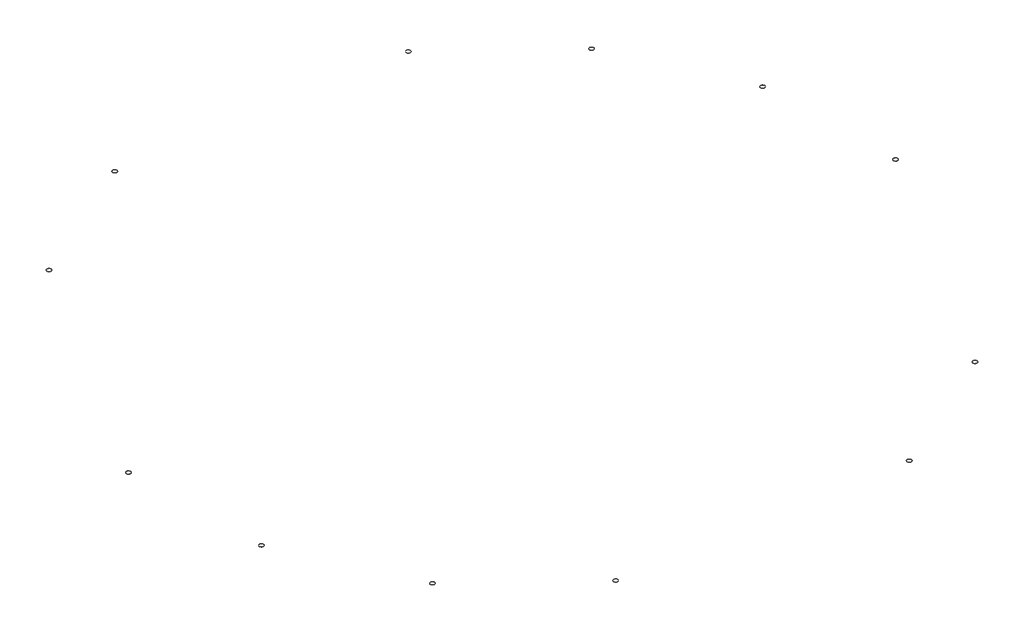
from build123d import *

# Parameters (mm, degrees)
SKETCH2_R              = 25.4
SKETCH2_R_2            = 22.225
BOSS_EXTRUDE1_DEPTH    = 3.175
BOSS_EXTRUDE1_2_DEPTH  = 3.175
BOSS_EXTRUDE1_3_DEPTH  = 3.175
BOSS_EXTRUDE1_4_DEPTH  = 3.175
BOSS_EXTRUDE1_5_DEPTH  = 3.175
BOSS_EXTRUDE1_6_DEPTH  = 3.175
BOSS_EXTRUDE1_7_DEPTH  = 3.175
BOSS_EXTRUDE1_8_DEPTH  = 3.175
BOSS_EXTRUDE1_9_DEPTH  = 3.175
BOSS_EXTRUDE1_10_DEPTH = 3.175
BOSS_EXTRUDE1_11_DEPTH = 3.175
BOSS_EXTRUDE1_12_DEPTH = 3.175


with BuildPart() as part:
    # Sketch2 → Boss-Extrude1 (new body)
    with BuildSketch(Plane(origin=(0, 0, 0), x_dir=(1, 0, 0), z_dir=(0, 1, 0))):
        with Locations(Location((-3790.37532596, -857.674371981, 0), (0, 0, 270))):
            Circle(SKETCH2_R)
        with Locations(Location((-3790.37532596, -857.674371981, 0), (0, 0, 270))):
            Circle(SKETCH2_R_2, mode=Mode.SUBTRACT)
    extrude(amount=BOSS_EXTRUDE1_DEPTH)


with BuildPart() as body_2:
    # Sketch2 → Boss-Extrude1 2 (new body)
    with BuildSketch(Plane(origin=(0, 0, 0), x_dir=(1, 0, 0), z_dir=(0, 1, 0))):
        with Locations(Location((-3173.632411669, -2242.901637523, 0), (0, 0, 270))):
            Circle(SKETCH2_R)
        with Locations(Location((-3173.632411669, -2242.901637523, 0), (0, 0, 270))):
            Circle(SKETCH2_R_2, mode=Mode.SUBTRACT)
    extrude(amount=BOSS_EXTRUDE1_2_DEPTH)


with BuildPart() as body_3:
    # Sketch2 → Boss-Extrude1 3 (new body)
    with BuildSketch(Plane(origin=(0, 0, 0), x_dir=(1, 0, 0), z_dir=(0, 1, 0))):
        with Locations(Location((-658.126041858, -3830.067956712, 0), (0, 0, 270))):
            Circle(SKETCH2_R)
        with Locations(Location((-658.126041858, -3830.067956712, 0), (0, 0, 270))):
            Circle(SKETCH2_R_2, mode=Mode.SUBTRACT)
    extrude(amount=BOSS_EXTRUDE1_3_DEPTH)


with BuildPart() as body_4:
    # Sketch2 → Boss-Extrude1 4 (new body)
    with BuildSketch(Plane(origin=(0, 0, 0), x_dir=(1, 0, 0), z_dir=(0, 1, 0))):
        with Locations(Location((857.674371981, -3790.37532596, 0), (0, 0, 270))):
            Circle(SKETCH2_R)
        with Locations(Location((857.674371981, -3790.37532596, 0), (0, 0, 270))):
            Circle(SKETCH2_R_2, mode=Mode.SUBTRACT)
    extrude(amount=BOSS_EXTRUDE1_4_DEPTH)


with BuildPart() as body_5:
    # Sketch2 → Boss-Extrude1 5 (new body)
    with BuildSketch(Plane(origin=(0, 0, 0), x_dir=(1, 0, 0), z_dir=(0, 1, 0))):
        with Locations(Location((2242.901637523, -3173.632411669, 0), (0, 0, 270))):
            Circle(SKETCH2_R)
        with Locations(Location((2242.901637523, -3173.632411669, 0), (0, 0, 270))):
            Circle(SKETCH2_R_2, mode=Mode.SUBTRACT)
    extrude(amount=BOSS_EXTRUDE1_5_DEPTH)


with BuildPart() as body_6:
    # Sketch2 → Boss-Extrude1 6 (new body)
    with BuildSketch(Plane(origin=(0, 0, 0), x_dir=(1, 0, 0), z_dir=(0, 1, 0))):
        with Locations(Location((3286.667460706, -2073.732731751, 0), (0, 0, 270))):
            Circle(SKETCH2_R)
        with Locations(Location((3286.667460706, -2073.732731751, 0), (0, 0, 270))):
            Circle(SKETCH2_R_2, mode=Mode.SUBTRACT)
    extrude(amount=BOSS_EXTRUDE1_6_DEPTH)


with BuildPart() as body_7:
    # Sketch2 → Boss-Extrude1 7 (new body)
    with BuildSketch(Plane(origin=(0, 0, 0), x_dir=(1, 0, 0), z_dir=(0, 1, 0))):
        with Locations(Location((3790.37532596, 857.674371981, 0), (0, 0, 270))):
            Circle(SKETCH2_R)
        with Locations(Location((3790.37532596, 857.674371981, 0), (0, 0, 270))):
            Circle(SKETCH2_R_2, mode=Mode.SUBTRACT)
    extrude(amount=BOSS_EXTRUDE1_7_DEPTH)


with BuildPart() as body_8:
    # Sketch2 → Boss-Extrude1 8 (new body)
    with BuildSketch(Plane(origin=(0, 0, 0), x_dir=(1, 0, 0), z_dir=(0, 1, 0))):
        with Locations(Location((3173.632411669, 2242.901637523, 0), (0, 0, 270))):
            Circle(SKETCH2_R)
        with Locations(Location((3173.632411669, 2242.901637523, 0), (0, 0, 270))):
            Circle(SKETCH2_R_2, mode=Mode.SUBTRACT)
    extrude(amount=BOSS_EXTRUDE1_8_DEPTH)


with BuildPart() as body_9:
    # Sketch2 → Boss-Extrude1 9 (new body)
    with BuildSketch(Plane(origin=(0, 0, 0), x_dir=(1, 0, 0), z_dir=(0, 1, 0))):
        with Locations(Location((658.126041858, 3830.067956712, 0), (0, 0, 270))):
            Circle(SKETCH2_R)
        with Locations(Location((658.126041858, 3830.067956712, 0), (0, 0, 270))):
            Circle(SKETCH2_R_2, mode=Mode.SUBTRACT)
    extrude(amount=BOSS_EXTRUDE1_9_DEPTH)


with BuildPart() as body_10:
    # Sketch2 → Boss-Extrude1 10 (new body)
    with BuildSketch(Plane(origin=(0, 0, 0), x_dir=(1, 0, 0), z_dir=(0, 1, 0))):
        with Locations(Location((-857.674371981, 3790.37532596, 0), (0, 0, 270))):
            Circle(SKETCH2_R)
        with Locations(Location((-857.674371981, 3790.37532596, 0), (0, 0, 270))):
            Circle(SKETCH2_R_2, mode=Mode.SUBTRACT)
    extrude(amount=BOSS_EXTRUDE1_10_DEPTH)


with BuildPart() as body_11:
    # Sketch2 → Boss-Extrude1 11 (new body)
    with BuildSketch(Plane(origin=(0, 0, 0), x_dir=(1, 0, 0), z_dir=(0, 1, 0))):
        with Locations(Location((-2242.901637523, 3173.632411669, 0), (0, 0, 270))):
            Circle(SKETCH2_R)
        with Locations(Location((-2242.901637523, 3173.632411669, 0), (0, 0, 270))):
            Circle(SKETCH2_R_2, mode=Mode.SUBTRACT)
    extrude(amount=BOSS_EXTRUDE1_11_DEPTH)


with BuildPart() as body_12:
    # Sketch2 → Boss-Extrude1 12 (new body)
    with BuildSketch(Plane(origin=(0, 0, 0), x_dir=(1, 0, 0), z_dir=(0, 1, 0))):
        with Locations(Location((-3286.667460706, 2073.732731751, 0), (0, 0, 270))):
            Circle(SKETCH2_R)
        with Locations(Location((-3286.667460706, 2073.732731751, 0), (0, 0, 270))):
            Circle(SKETCH2_R_2, mode=Mode.SUBTRACT)
    extrude(amount=BOSS_EXTRUDE1_12_DEPTH)


solid = Compound([part.part, body_2.part, body_3.part, body_4.part, body_5.part, body_6.part, body_7.part, body_8.part, body_9.part, body_10.part, body_11.part, body_12.part])
